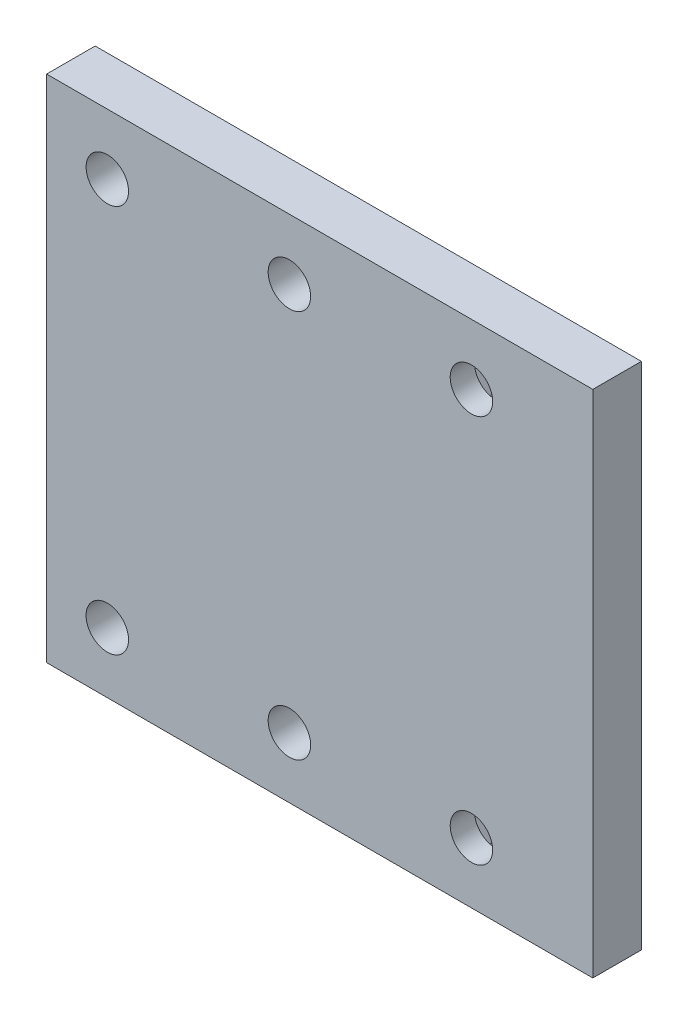
from build123d import *

# Parameters (mm, degrees)
SKETCH1_W           = 45
SKETCH1_H           = 42
BOSS_EXTRUDE1_DEPTH = 4
SKETCH2_R           = 1.75
CUT_EXTRUDE1_DEPTH  = 32.036269106
SKETCH3_R           = 1.75
CUT_EXTRUDE2_DEPTH  = 32.036269106
CUT_EXTRUDE4_DEPTH  = 2


with BuildPart() as part:
    # Sketch1 → Boss-Extrude1 (new body)
    with BuildSketch(Plane.XY):
        Rectangle(SKETCH1_W, SKETCH1_H)
    extrude(amount=BOSS_EXTRUDE1_DEPTH)

    # Sketch2 → Cut-Extrude1 (cut, through all)
    with BuildSketch(Plane.XY.offset(4)):
        with Locations((-17.5, 16)):
            Circle(SKETCH2_R)
        with Locations((-2.5, 16)):
            Circle(SKETCH2_R)
        with Locations(Location((-2.5, -16, 0), (0, 0, 180))):
            Circle(SKETCH2_R)
        with Locations(Location((-17.5, -16, 0), (0, 0, 180))):
            Circle(SKETCH2_R)
    extrude(amount=-CUT_EXTRUDE1_DEPTH, mode=Mode.SUBTRACT)

    # Sketch3 → Cut-Extrude2 (cut, through all)
    with BuildSketch(Plane.XY.offset(4)):
        with Locations((12.5, 16)):
            Circle(SKETCH3_R)
        with Locations(Location((12.5, -16, 0), (0, 0, 180))):
            Circle(SKETCH3_R)
    extrude(amount=-CUT_EXTRUDE2_DEPTH, mode=Mode.SUBTRACT)

    # Sketch5 → Cut-Extrude4 (cut)
    with BuildSketch(Plane(origin=(0, 0, 0), x_dir=(-1, 0, 0), z_dir=(0, 0, -1))):
        Polygon((-9.209103466, -16), (-10.854551733, -13.15), (-14.145448267, -13.15), (-15.790896534, -16), (-14.145448267, -18.85), (-10.854551733, -18.85), align=None)
        Polygon((-10.854551733, 18.85), (-9.209103466, 16), (-10.854551733, 13.15), (-14.145448267, 13.15), (-15.790896534, 16), (-14.145448267, 18.85), align=None)
    extrude(amount=-CUT_EXTRUDE4_DEPTH, mode=Mode.SUBTRACT)


solid = part.part
